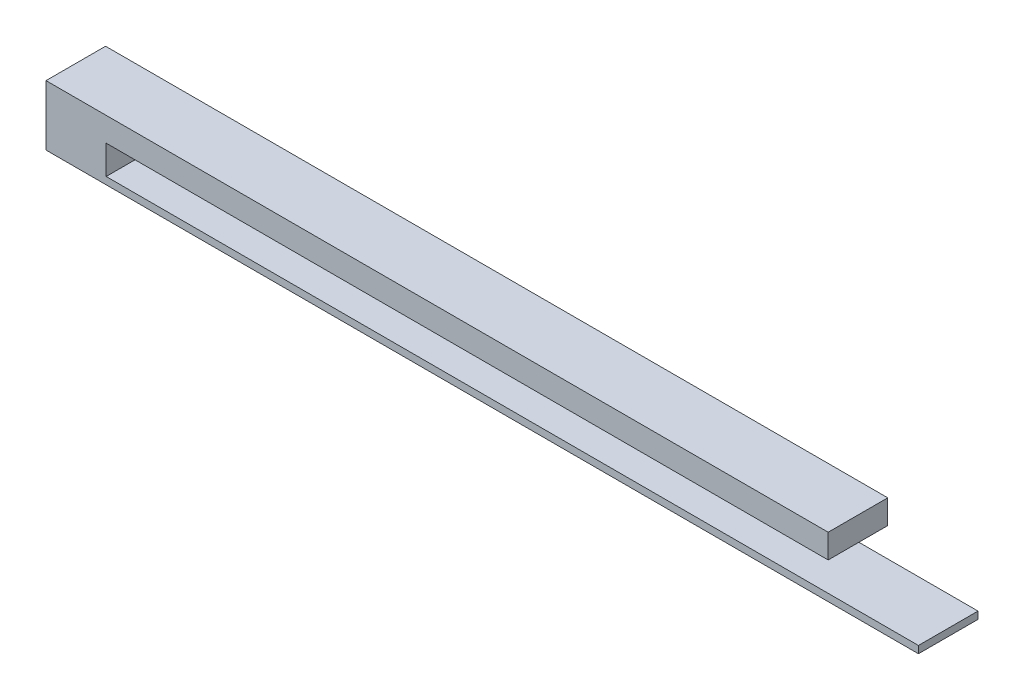
from build123d import *

# Parameters (mm, degrees)
SKETCH1_W           = 145
SKETCH1_H           = 9.9
BOSS_EXTRUDE1_DEPTH = 10
SKETCH2_W           = 15.17609959
SKETCH2_H           = 4.8
CUT_EXTRUDE1_DEPTH  = 135
SKETCH3_W           = 11.317178526
SKETCH3_H           = 5.799550562
CUT_EXTRUDE2_DEPTH  = 15


with BuildPart() as part:
    # Sketch1 → Boss-Extrude1 (new body)
    with BuildSketch(Plane(origin=(0, 0, 0), x_dir=(1, 0, 0), z_dir=(0, 1, 0))):
        Rectangle(SKETCH1_W, SKETCH1_H)
    extrude(amount=BOSS_EXTRUDE1_DEPTH)

    # Sketch2 → Cut-Extrude1 (cut)
    with BuildSketch(Plane(origin=(72.5, 0, 0), x_dir=(0, 0, -1), z_dir=(1, 0, 0))):
        with Locations((0, 3.6)):
            Rectangle(SKETCH2_W, SKETCH2_H)
    extrude(amount=-CUT_EXTRUDE1_DEPTH, mode=Mode.SUBTRACT)

    # Sketch3 → Cut-Extrude2 (cut)
    with BuildSketch(Plane(origin=(72.5, 0, 0), x_dir=(0, 0, -1), z_dir=(1, 0, 0))):
        with Locations((0, 7.899775281)):
            Rectangle(SKETCH3_W, SKETCH3_H)
    extrude(amount=-CUT_EXTRUDE2_DEPTH, mode=Mode.SUBTRACT)


solid = part.part
